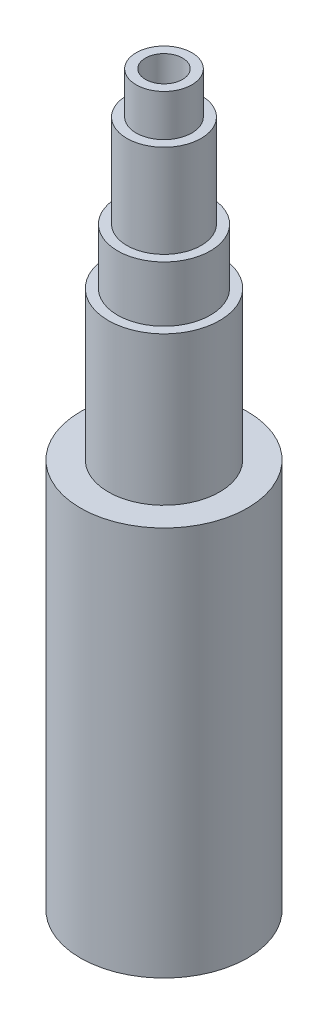
from build123d import *

# Parameters (mm, degrees)
SKETCH1_R                 = 9
BASE_SECTION_DEPTH        = 42
SKETCH2_R                 = 6
SECOND_SECTION_DEPTH      = 16
SKETCH3_R                 = 5
BEARING_SECTION_DEPTH     = 6
SKETCH4_R                 = 4
SEAL_SECTION_DEPTH        = 10
SKETCH5_R                 = 3
IMPELLER_SECTION_DEPTH    = 4.5
SKETCH6_R                 = 2
IMPELLER_SCREW_HOLE_DEPTH = 10
SKETCH7_R                 = 4
MOTOR_SHAFT_HOLE_DEPTH    = 32


with BuildPart() as part:
    # Sketch1 → base section (new body)
    with BuildSketch(Plane(origin=(0, 0, 0), x_dir=(1, 0, 0), z_dir=(0, 1, 0))):
        with Locations(Location((0, 0, 0), (0, 0, 90))):
            Circle(SKETCH1_R)
    extrude(amount=BASE_SECTION_DEPTH)

    # Sketch2 → second section (add)
    with BuildSketch(Plane(origin=(0, 42, 0), x_dir=(1, 0, 0), z_dir=(0, 1, 0))):
        with Locations(Location((0, 0, 0), (0, 0, 270))):
            Circle(SKETCH2_R)
    extrude(amount=SECOND_SECTION_DEPTH)

    # Sketch3 → bearing section (add)
    with BuildSketch(Plane(origin=(0, 58, 0), x_dir=(1, 0, 0), z_dir=(0, 1, 0))):
        with Locations(Location((0, 0, 0), (0, 0, 270))):
            Circle(SKETCH3_R)
    extrude(amount=BEARING_SECTION_DEPTH)

    # Sketch4 → seal section (add)
    with BuildSketch(Plane(origin=(0, 64, 0), x_dir=(1, 0, 0), z_dir=(0, 1, 0))):
        with Locations(Location((0, 0, 0), (0, 0, 270))):
            Circle(SKETCH4_R)
    extrude(amount=SEAL_SECTION_DEPTH)

    # Sketch5 → impeller section (add)
    with BuildSketch(Plane(origin=(0, 74, 0), x_dir=(1, 0, 0), z_dir=(0, 1, 0))):
        with Locations(Location((0, 0, 0), (0, 0, 270))):
            Circle(SKETCH5_R)
    extrude(amount=IMPELLER_SECTION_DEPTH)

    # Sketch6 → impeller screw hole (cut)
    with BuildSketch(Plane(origin=(0, 78.5, 0), x_dir=(1, 0, 0), z_dir=(0, 1, 0))):
        with Locations(Location((0, 0, 0), (0, 0, 270))):
            Circle(SKETCH6_R)
    extrude(amount=-IMPELLER_SCREW_HOLE_DEPTH, mode=Mode.SUBTRACT)

    # Sketch7 → motor shaft hole (cut)
    with BuildSketch(Plane(origin=(0, 0, 0), x_dir=(-1, 0, 0), z_dir=(0, -1, 0))):
        with Locations(Location((0, 0, 0), (0, 0, 270))):
            Circle(SKETCH7_R)
    extrude(amount=-MOTOR_SHAFT_HOLE_DEPTH, mode=Mode.SUBTRACT)


solid = part.part
